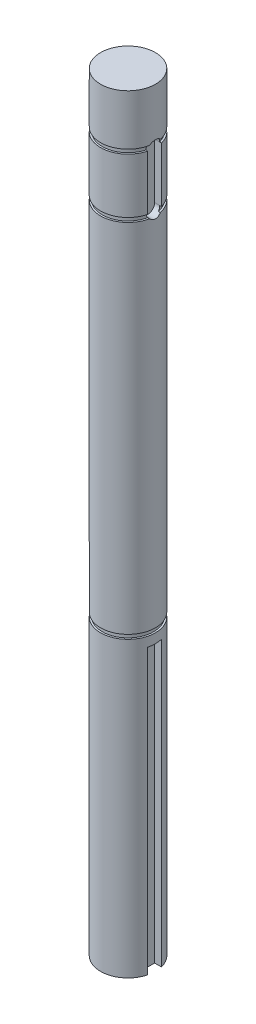
from build123d import *

# Parameters (mm, degrees)
SKETCH1_R           = 2.5
BOSS_EXTRUDE1_DEPTH = 70
SKETCH2_W           = 8.002740347
SKETCH2_H           = 0.39
SKETCH3_W           = 11.814730857
SKETCH3_H           = 0.39
SKETCH4_W           = 12.637510598
SKETCH4_H           = 0.39
CUT_EXTRUDE1_DEPTH  = 0.7
SKETCH6_W           = 1.25
SKETCH6_H           = 31.626867322
CUT_EXTRUDE2_DEPTH  = 0.7


with BuildPart() as part:
    # Sketch1 → Boss-Extrude1 (new body)
    with BuildSketch(Plane(origin=(0, 0, 0), x_dir=(1, 0, 0), z_dir=(0, 1, 0))):
        with Locations(Location((0, 0, 0), (0, 0, 270))):
            Circle(SKETCH1_R)
    extrude(amount=BOSS_EXTRUDE1_DEPTH)

    # Sketch2 → Cut-Revolve1 (revolve, cut)
    with BuildSketch(Plane(origin=(0, 0, 0), x_dir=(0, 0, -1), z_dir=(1, 0, 0))):
        with Locations((-6.341370174, 65.195)):
            Rectangle(SKETCH2_W, SKETCH2_H)
    revolve(axis=Axis((0, 67.145702963, 0), (0, -1, 0)), mode=Mode.SUBTRACT)

    # Sketch3 → Cut-Revolve2 (revolve, cut)
    with BuildSketch(Plane(origin=(0, 0, 0), x_dir=(0, 0, -1), z_dir=(1, 0, 0)), mode=Mode.PRIVATE) as cut_revolve2_sk:
        with Locations((-8.247365429, 59.805)):
            Rectangle(SKETCH3_W, SKETCH3_H)
    revolve(cut_revolve2_sk.sketch.rotate(Axis((0, 61.014608436, 0), (0, -1, 0)), 180), axis=Axis((0, 61.014608436, 0), (0, -1, 0)), mode=Mode.SUBTRACT)

    # Sketch4 → Cut-Revolve3 (revolve, cut)
    with BuildSketch(Plane(origin=(0, 0, 0), x_dir=(0, 0, -1), z_dir=(1, 0, 0)), mode=Mode.PRIVATE) as cut_revolve3_sk:
        with Locations((-8.658755299, 26.915)):
            Rectangle(SKETCH4_W, SKETCH4_H)
    revolve(cut_revolve3_sk.sketch.rotate(Axis((0, 27.341534507, 0), (0, -1, 0)), 180), axis=Axis((0, 27.341534507, 0), (0, -1, 0)), mode=Mode.SUBTRACT)

    # Sketch5 → Cut-Extrude1 (cut)
    with BuildSketch(Plane(origin=(2.5, 0, 0), x_dir=(0, 0, -1), z_dir=(1, 0, 0))):
        with BuildLine():
            Line((0.625, 65), (0.625, 60))
            ThreePointArc((0.625, 60), (0, 59.375), (-0.625, 60))
            Line((-0.625, 60), (-0.625, 65))
            ThreePointArc((-0.625, 65), (0, 65.625), (0.625, 65))
        make_face()
    extrude(amount=-CUT_EXTRUDE1_DEPTH, mode=Mode.SUBTRACT)

    # Sketch6 → Cut-Extrude2 (cut)
    with BuildSketch(Plane(origin=(2.5, 0, 0), x_dir=(0, 0, -1), z_dir=(1, 0, 0))):
        with Locations((0, 10.046566339)):
            Rectangle(SKETCH6_W, SKETCH6_H)
    extrude(amount=-CUT_EXTRUDE2_DEPTH, mode=Mode.SUBTRACT)


solid = part.part
